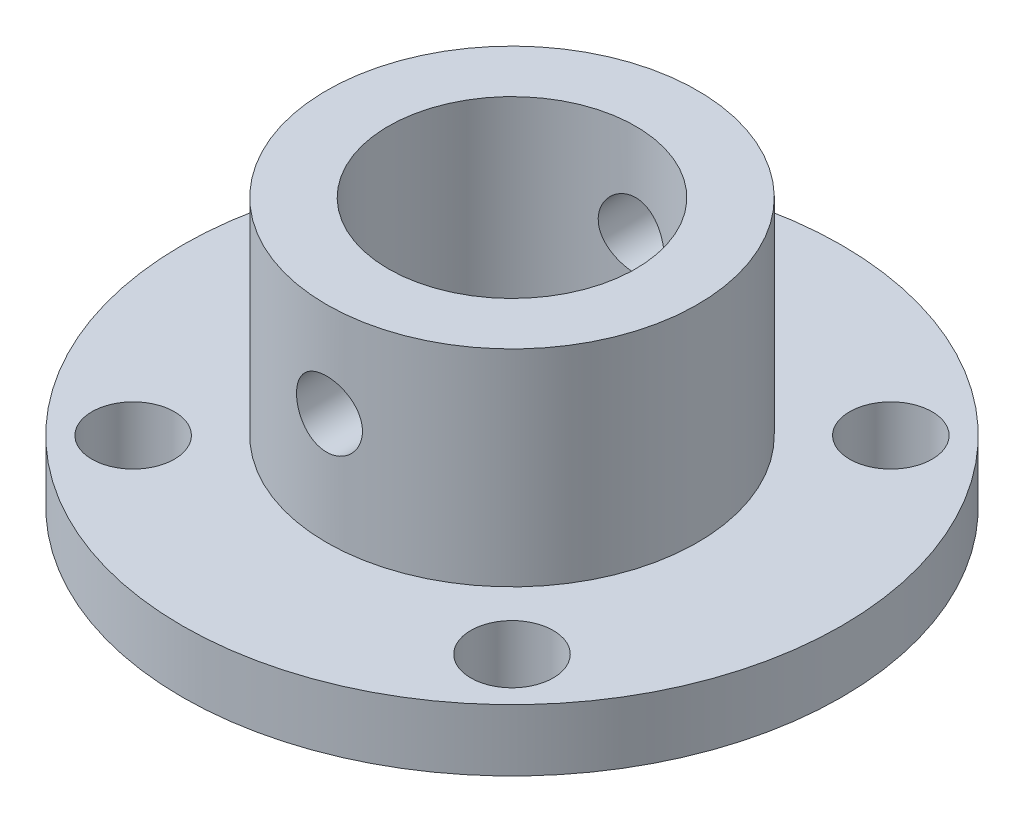
from build123d import *

# Parameters (mm, degrees)
SKETCH2_R           = 16
BOSS_EXTRUDE1_DEPTH = 3
SKETCH3_R           = 6
SKETCH3_R_2         = 2
CUT_EXTRUDE1_DEPTH  = 3
BOSS_EXTRUDE2_START = 10
SKETCH4_R           = 9
SKETCH4_R_2         = 6
BOSS_EXTRUDE2_DEPTH = 10
SKETCH5_R           = 1.6
CUT_EXTRUDE2_DEPTH  = 10


with BuildPart() as part:
    # Sketch2 → Boss-Extrude1 (new body)
    with BuildSketch(Plane(origin=(0, 0, 0), x_dir=(1, 0, 0), z_dir=(0, 1, 0))):
        Circle(SKETCH2_R)
    extrude(amount=BOSS_EXTRUDE1_DEPTH)

    # Sketch3 → Cut-Extrude1 (cut)
    with BuildSketch(Plane(origin=(0, 3, 0), x_dir=(1, 0, 0), z_dir=(0, 1, 0))):
        Circle(SKETCH3_R)
        with Locations((-9.192388155, 9.192388155)):
            Circle(SKETCH3_R_2)
        with Locations((9.192388155, 9.192388155)):
            Circle(SKETCH3_R_2)
        with Locations((9.192388155, -9.192388155)):
            Circle(SKETCH3_R_2)
        with Locations((-9.192388155, -9.192388155)):
            Circle(SKETCH3_R_2)
    extrude(amount=-CUT_EXTRUDE1_DEPTH, mode=Mode.SUBTRACT)

    # Sketch4 → Boss-Extrude2 (add)
    with BuildSketch(Plane(origin=(0, 3, 0), x_dir=(1, 0, 0), z_dir=(0, 1, 0)).offset(BOSS_EXTRUDE2_START)):
        Circle(SKETCH4_R)
        Circle(SKETCH4_R_2, mode=Mode.SUBTRACT)
    extrude(amount=-BOSS_EXTRUDE2_DEPTH)

    # Sketch5 → Cut-Extrude2 (cut, symmetric)
    with BuildSketch(Plane.XY):
        with Locations((0, 8.4)):
            Circle(SKETCH5_R)
    extrude(amount=CUT_EXTRUDE2_DEPTH, both=True, mode=Mode.SUBTRACT)


solid = part.part
